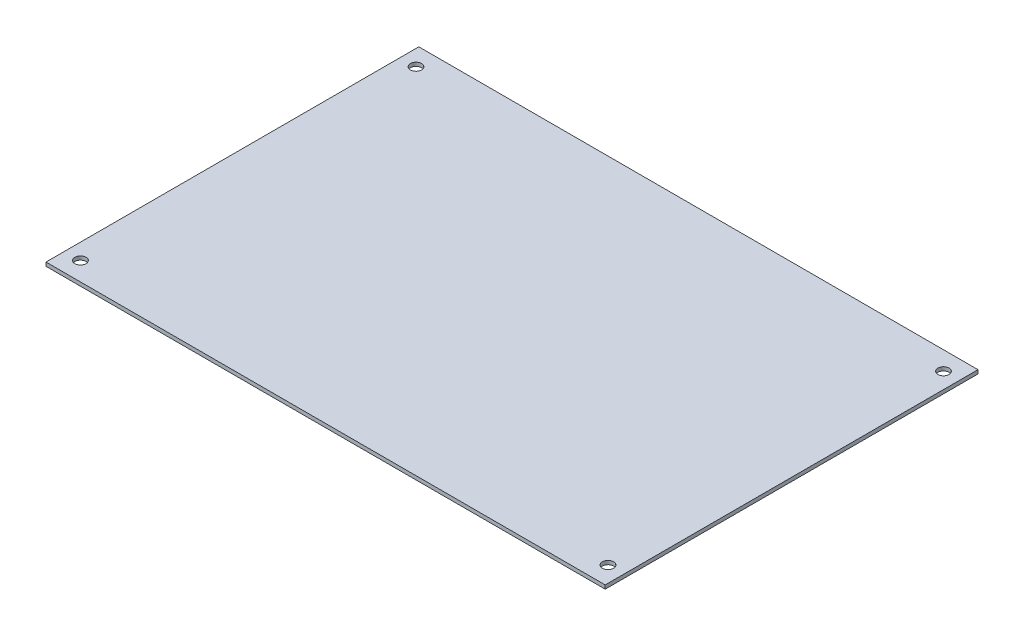
from build123d import *

# Parameters (mm, degrees)
SKETCH_1_W               = 150
SKETCH_1_H               = 100
EXTRUDE_1_DEPTH          = 0.5
CUT_EXTRUDE_1_DEPTH      = 91.140168626
CUT_EXTRUDE_1_DEPTH_BACK = 91.140168626
SKETCH_2_R               = 1.5


with BuildPart() as part:
    # 草图1 → 凸台-拉伸1 (new, symmetric)
    with BuildSketch(Plane(origin=(0, 0, 0), x_dir=(1, 0, 0), z_dir=(0, 1, 0))):
        Rectangle(SKETCH_1_W, SKETCH_1_H)
    extrude(amount=EXTRUDE_1_DEPTH, both=True)

    # 草图2 → 切除-拉伸1 (cut, two sides: drawn at the far end of the back side and taken through both)
    with BuildSketch(Plane(origin=(0, 0, 0), x_dir=(1, 0, 0), z_dir=(0, 1, 0)).offset(-CUT_EXTRUDE_1_DEPTH_BACK)):
        with Locations(Location((-70.75, 45, 0), (0, 0, 270))):
            Circle(SKETCH_2_R)
        with Locations(Location((70.75, 45, 0), (0, 0, 270))):
            Circle(SKETCH_2_R)
        with Locations(Location((-70.75, -45, 0), (0, 0, 270))):
            Circle(SKETCH_2_R)
        with Locations(Location((70.75, -45, 0), (0, 0, 270))):
            Circle(SKETCH_2_R)
    extrude(amount=CUT_EXTRUDE_1_DEPTH + CUT_EXTRUDE_1_DEPTH_BACK, mode=Mode.SUBTRACT)


solid = part.part
